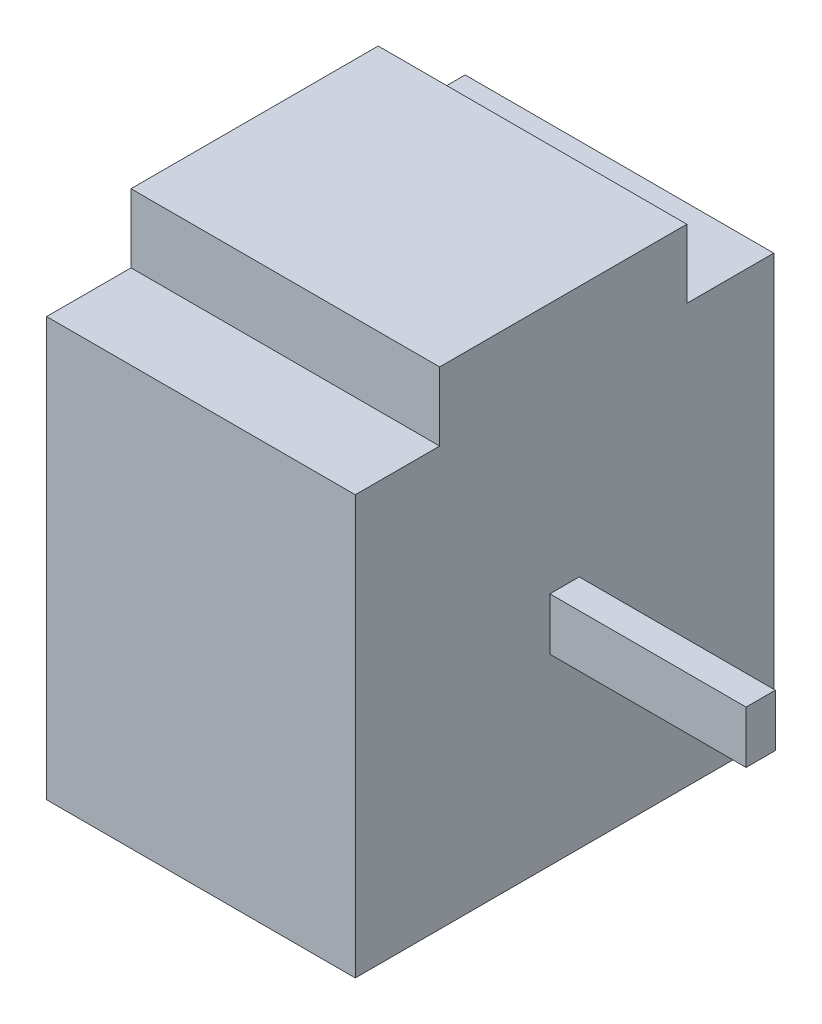
from build123d import *

# Parameters (mm, degrees)
SKETCH1_W           = 16
SKETCH1_H           = 16
SKETCH1_W_2         = 9.45
SKETCH1_H_2         = 2.62
BOSS_EXTRUDE3_DEPTH = 11.8
SKETCH2_W           = 1.12
SKETCH2_H           = 2
BOSS_EXTRUDE4_DEPTH = 7.5


with BuildPart() as part:
    # Sketch1 → Boss-Extrude3 (new body)
    with BuildSketch(Plane(origin=(0, 0, 0), x_dir=(0, 0, -1), z_dir=(1, 0, 0))):
        with Locations((8, 8)):
            Rectangle(SKETCH1_W, SKETCH1_H)
        with Locations((7.95, 17.31)):
            Rectangle(SKETCH1_W_2, SKETCH1_H_2)
    extrude(amount=BOSS_EXTRUDE3_DEPTH)

    # Sketch2 → Boss-Extrude4 (add)
    with BuildSketch(Plane(origin=(11.8, 0, 0), x_dir=(0, 0, -1), z_dir=(1, 0, 0))):
        with Locations((8, 8)):
            Rectangle(SKETCH2_W, SKETCH2_H)
    extrude(amount=BOSS_EXTRUDE4_DEPTH)


solid = part.part
